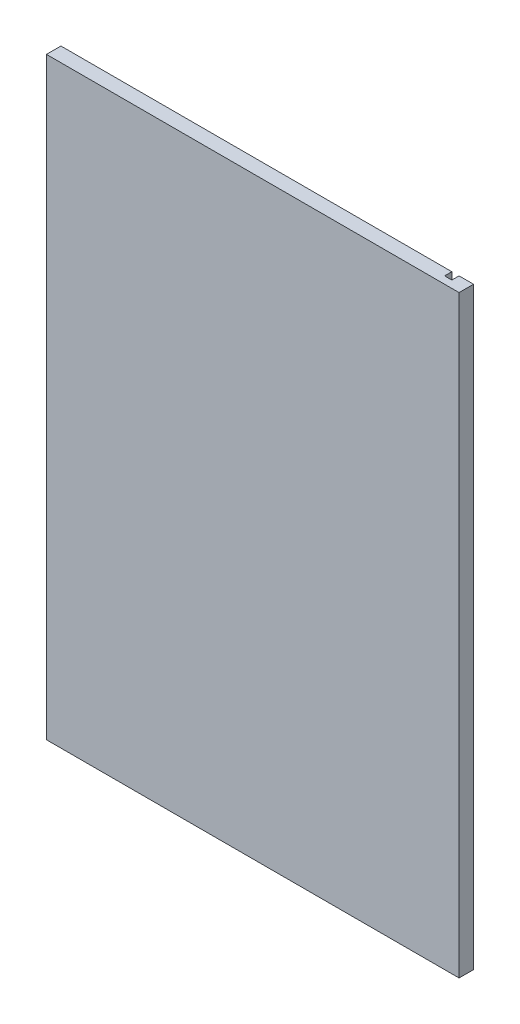
from build123d import *

# Parameters (mm, degrees)
ESQUISSE1_W             = 285
ESQUISSE1_H             = 410
BOSS_EXTRU_1_DEPTH      = 10
ESQUISSE2_W             = 5
ESQUISSE2_H             = 410
ENL_V_MAT_EXTRU_1_DEPTH = 5


with BuildPart() as part:
    # Esquisse1 → Boss.-Extru.1 (new body)
    with BuildSketch(Plane.XY):
        with Locations((-142.5, 205)):
            Rectangle(ESQUISSE1_W, ESQUISSE1_H)
    extrude(amount=BOSS_EXTRU_1_DEPTH)

    # Esquisse2 → Enlèv. mat.-Extru.1 (cut)
    with BuildSketch(Plane(origin=(0, 0, 0), x_dir=(-1, 0, 0), z_dir=(0, 0, -1))):
        with Locations((12.5, 205)):
            Rectangle(ESQUISSE2_W, ESQUISSE2_H)
    extrude(amount=-ENL_V_MAT_EXTRU_1_DEPTH, mode=Mode.SUBTRACT)


solid = part.part
